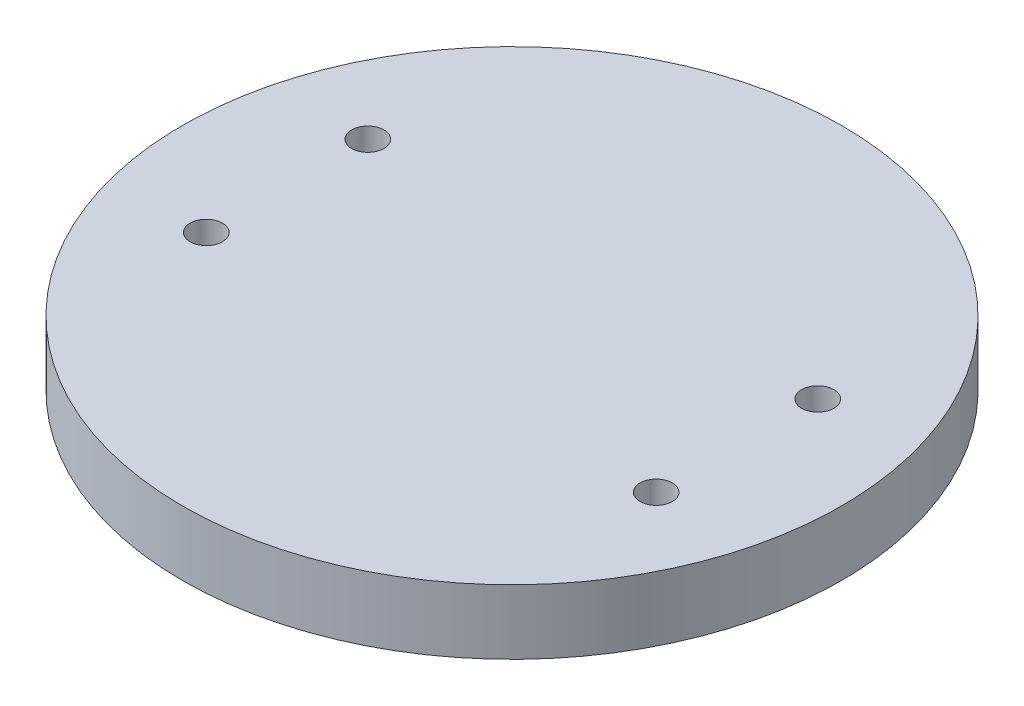
from build123d import *

# Parameters (mm, degrees)
SKETCH1_R           = 64.77
BOSS_EXTRUDE1_DEPTH = 12.7
SKETCH2_R           = 3.175
CUT_EXTRUDE1_DEPTH  = 93.47483874


with BuildPart() as part:
    # Sketch1 → Boss-Extrude1 (new body)
    with BuildSketch(Plane(origin=(0, 0, 0), x_dir=(1, 0, 0), z_dir=(0, 1, 0))):
        with Locations(Location((0, 0, 0), (0, 0, 270))):
            Circle(SKETCH1_R)
    extrude(amount=BOSS_EXTRUDE1_DEPTH)

    # Sketch2 → Cut-Extrude1 (cut, through all)
    with BuildSketch(Plane(origin=(0, 12.7, 0), x_dir=(1, 0, 0), z_dir=(0, 1, 0))):
        with Locations(Location((-44.214813621, 15.875, 0), (0, 0, 270))):
            Circle(SKETCH2_R)
        with Locations(Location((-44.214813621, -15.875, 0), (0, 0, 90))):
            Circle(SKETCH2_R)
        with Locations(Location((44.214813621, -15.875, 0), (0, 0, 270))):
            Circle(SKETCH2_R)
        with Locations(Location((44.214813621, 15.875, 0), (0, 0, 90))):
            Circle(SKETCH2_R)
    extrude(amount=-CUT_EXTRUDE1_DEPTH, mode=Mode.SUBTRACT)


solid = part.part
